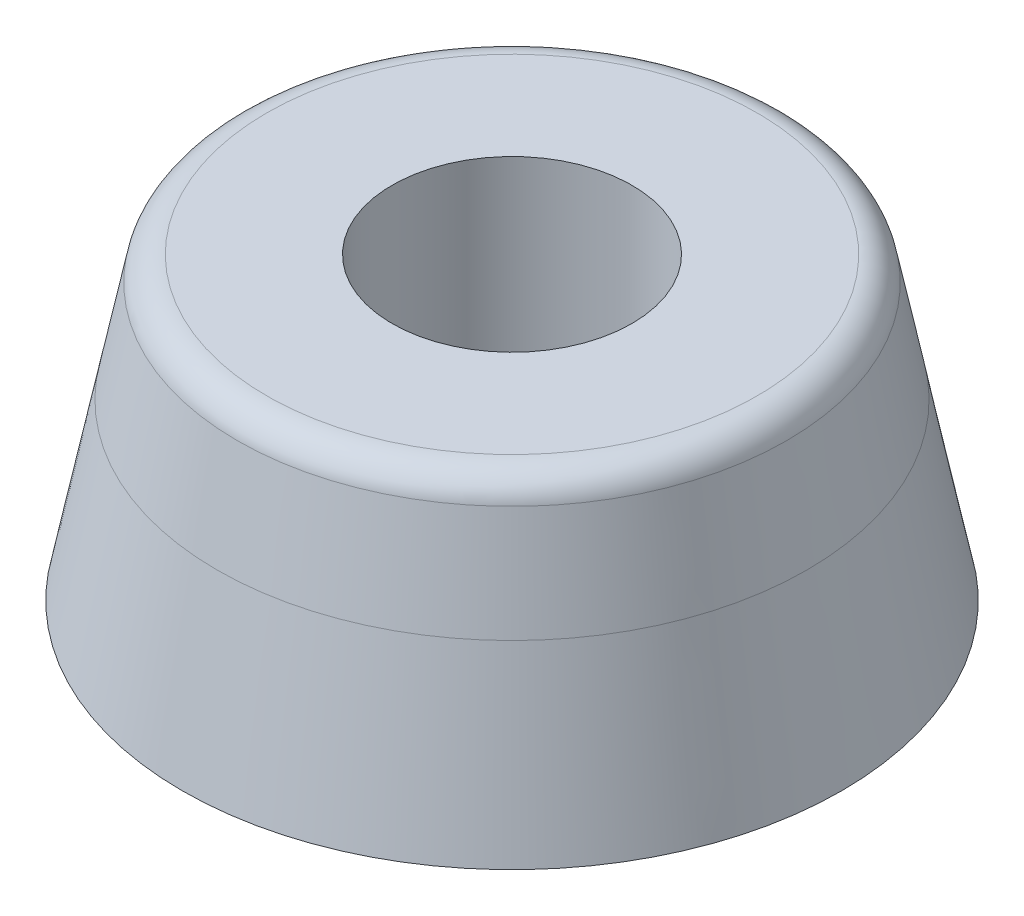
from build123d import *

# Parameters (mm, degrees)
FILLET_1_R = 1


with BuildPart() as part:
    # 草图6 → 旋转1 (revolve)
    with BuildSketch(Plane.XY):
        Polygon((1.65, 0), (1.65, 4), (4, 4), (4, 10), (9, 10), (11, 0), align=None)
    revolve(axis=Axis((0, 0, 0), (0, 1, 0)))

    # 圆角1
    fillet_1_edges = [part.edges().sort_by_distance(p)[0] for p in [
        (-9, 10, 0),
    ]]
    fillet(fillet_1_edges, radius=FILLET_1_R)


solid = part.part
